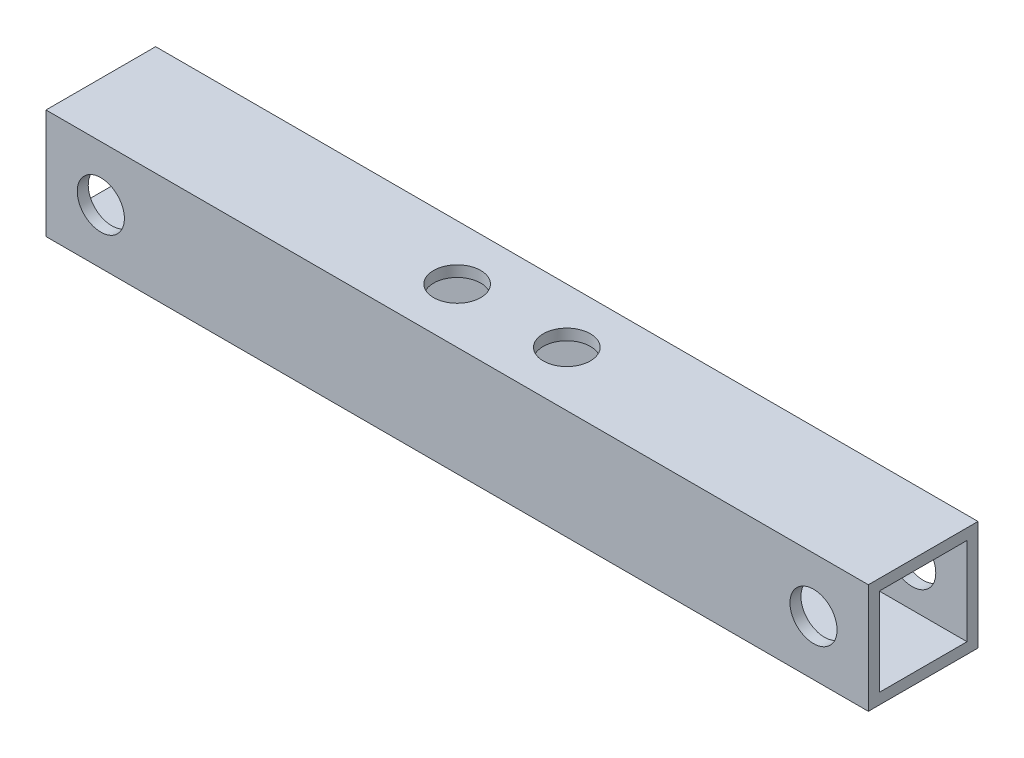
from build123d import *

# Parameters (mm, degrees)
SKETCH_1_W          = 10
SKETCH_1_H          = 10
SKETCH_1_W_2        = 8
SKETCH_1_H_2        = 8
EXTRUDE_1_DEPTH     = 75
SKETCH_2_R          = 2.15
CUT_EXTRUDE_1_DEPTH = 76.828754441
SKETCH_3_R          = 2.15
CUT_EXTRUDE_2_DEPTH = 76.828754441


with BuildPart() as part:
    # ｽｹｯﾁ1 → 押し出し-薄板1 (new body)
    with BuildSketch(Plane(origin=(0, 0, 0), x_dir=(0, 0, -1), z_dir=(1, 0, 0))):
        Rectangle(SKETCH_1_W, SKETCH_1_H)
        Rectangle(SKETCH_1_W_2, SKETCH_1_H_2, mode=Mode.SUBTRACT)
    extrude(amount=EXTRUDE_1_DEPTH)

    # ｽｹｯﾁ2 → ｶｯﾄ - 押し出し1 (cut, through all)
    with BuildSketch(Plane.XY.offset(5)):
        with Locations((70, 0)):
            Circle(SKETCH_2_R)
        with Locations(Location((5, 0, 0), (0, 0, 90))):
            Circle(SKETCH_2_R)
    extrude(amount=-CUT_EXTRUDE_1_DEPTH, mode=Mode.SUBTRACT)

    # ｽｹｯﾁ3 → ｶｯﾄ - 押し出し2 (cut, through all)
    with BuildSketch(Plane(origin=(0, 5, 0), x_dir=(1, 0, 0), z_dir=(0, 1, 0))):
        with Locations(Location((42.5, 0, 0), (0, 0, 270))):
            Circle(SKETCH_3_R)
        with Locations(Location((32.5, 0, 0), (0, 0, 270))):
            Circle(SKETCH_3_R)
    extrude(amount=-CUT_EXTRUDE_2_DEPTH, mode=Mode.SUBTRACT)


solid = part.part
